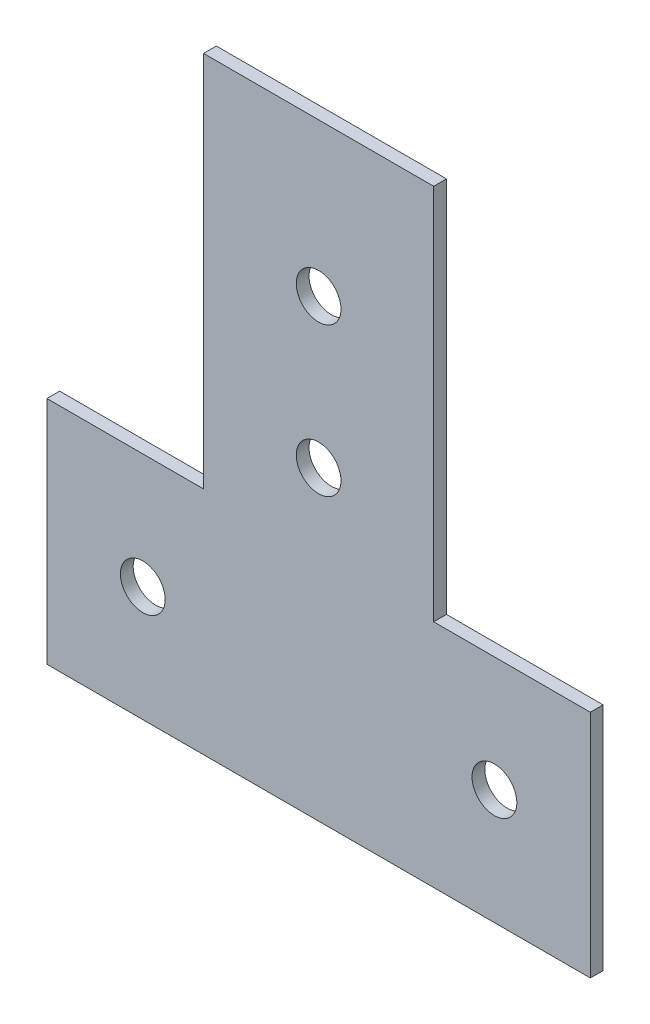
from build123d import *

# Parameters (mm, degrees)
EXTRUDE_1_DEPTH     = 2
SKETCH_2_R          = 3.5
CUT_EXTRUDE_1_DEPTH = 88.973007224


with BuildPart() as part:
    # 草图1 → 凸台-拉伸1 (new body)
    with BuildSketch(Plane.XY):
        Polygon((-42.5, -18), (42.5, -18), (42.5, 18), (18, 18), (18, 77), (-18, 77), (-18, 18), (-42.5, 18), align=None)
    extrude(amount=EXTRUDE_1_DEPTH)

    # 草图2 → 切除-拉伸1 (cut, through all)
    with BuildSketch(Plane.XY.offset(2)):
        with Locations((0, 53.096257537)):
            Circle(SKETCH_2_R)
        with Locations((0, 29.852182948)):
            Circle(SKETCH_2_R)
        with Locations((-27.5, 0)):
            Circle(SKETCH_2_R)
        with Locations(Location((27.5, 0, 0), (0, 0, 180))):
            Circle(SKETCH_2_R)
    extrude(amount=-CUT_EXTRUDE_1_DEPTH, mode=Mode.SUBTRACT)


solid = part.part
